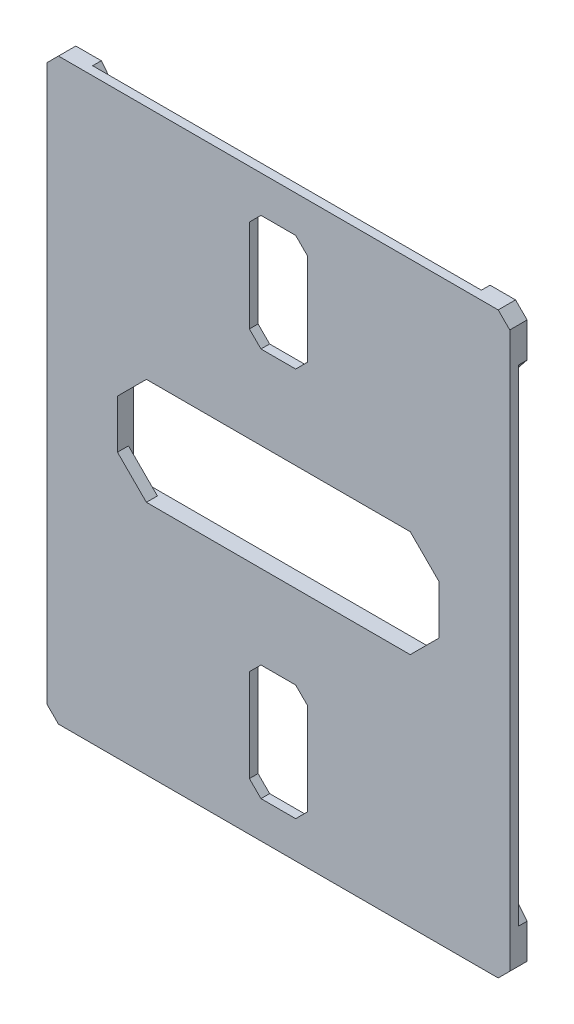
from build123d import *

# Parameters (mm, degrees)
ESBO_O2_W                = 80
ESBO_O2_H                = 100
ESBO_O2_W_2              = 55.6
ESBO_O2_H_2              = 18.4
RESSALTO_EXTRUS_O1_DEPTH = 0.8
RESSALTO_EXTRUS_O2_DEPTH = 2.2
CHANFRO3_SIZE            = 5
ESBO_O5_W                = 10
ESBO_O5_H                = 20
CORTE_EXTRUS_O1_DEPTH    = 10
CHANFRO4_SIZE            = 2
CHANFRO5_SIZE            = 2
RESSALTO_EXTRUS_O3_DEPTH = 0.7
ESBO_O7_W                = 61.8
ESBO_O7_H                = 24.6
ESBO_O7_W_2              = 55.6
ESBO_O7_H_2              = 18.4
RESSALTO_EXTRUS_O4_DEPTH = 2
ESBO_O8_W                = 61.8
ESBO_O8_H                = 24.6
RESSALTO_EXTRUS_O5_DEPTH = 0.6
CHANFRO6_SIZE            = 5
ESBO_O11_W               = 55.6
ESBO_O11_H               = 18.4
CORTE_EXTRUS_O2_DEPTH    = 0.9


with BuildPart() as part:
    # Esboço2 → Ressalto-extrusão1 (new body)
    with BuildSketch(Plane.XY):
        Rectangle(ESBO_O2_W, ESBO_O2_H)
        Rectangle(ESBO_O2_W_2, ESBO_O2_H_2, mode=Mode.SUBTRACT)
    extrude(amount=RESSALTO_EXTRUS_O1_DEPTH)

    # Esboço4 → Ressalto-extrusão2 (add)
    with BuildSketch(Plane(origin=(0, 0, 0), x_dir=(-1, 0, 0), z_dir=(0, 0, -1))):
        Polygon((40, -41.996094703), (20.243124237, -17.3), (35.9, -17.3), (35.9, 17.3), (20.243124237, 17.3), (40, 41.996094703), (40, 50), (33.596875763, 50), (7.436875763, 17.3), (-7.436875763, 17.3), (-33.596875763, 50), (-40, 50), (-40, 41.996094703), (-20.243124237, 17.3), (-35.9, 17.3), (-35.9, -17.3), (-20.243124237, -17.3), (-40, -41.996094703), (-40, -50), (-33.596875763, -50), (-7.436875763, -17.3), (7.436875763, -17.3), (33.596875763, -50), (40, -50), align=None)
        Polygon((3.436875763, 12.3), (5, 12.3), (16.243124237, 12.3), (30.9, 12.3), (30.9, -12.3), (16.243124237, -12.3), (5, -12.3), (3.436875763, -12.3), (-3.436875763, -12.3), (-5, -12.3), (-16.243124237, -12.3), (-30.9, -12.3), (-30.9, 12.3), (-16.243124237, 12.3), (-5, 12.3), (-2.810379517, 12.3), align=None, mode=Mode.SUBTRACT)
    extrude(amount=RESSALTO_EXTRUS_O2_DEPTH)

    # Chanfro3
    chanfro3_edges = [part.edges().sort_by_distance(p)[0] for p in [
        (-35.9, 17.3, -1.1),
        (35.9, 17.3, -1.1),
        (35.9, -17.3, -1.1),
        (-35.9, -17.3, -1.1),
    ]]
    chamfer(chanfro3_edges, length=CHANFRO3_SIZE)

    # Esboço5 → Corte-extrusão1 (cut)
    with BuildSketch(Plane(origin=(0, 0, 0), x_dir=(-1, 0, 0), z_dir=(0, 0, -1))):
        with Locations((0, 33.65)):
            Rectangle(ESBO_O5_W, ESBO_O5_H)
        with Locations((0, -33.65)):
            Rectangle(ESBO_O5_W, ESBO_O5_H)
    extrude(amount=-CORTE_EXTRUS_O1_DEPTH, mode=Mode.SUBTRACT)

    # Chanfro4
    chanfro4_edges = [part.edges().sort_by_distance(p)[0] for p in [
        (-5, 43.65, 0.4),
        (-5, 23.65, 0.4),
        (5, 23.65, 0.4),
        (5, 43.65, 0.4),
        (-5, -23.65, 0.4),
        (-5, -43.65, 0.4),
        (5, -43.65, 0.4),
        (5, -23.65, 0.4),
    ]]
    chamfer(chanfro4_edges, length=CHANFRO4_SIZE)

    # Chanfro5
    chanfro5_edges = [part.edges().sort_by_distance(p)[0] for p in [
        (-40, 50, -0.7),
        (40, 50, -0.7),
        (40, -50, -0.7),
        (-40, -50, -0.7),
    ]]
    chamfer(chanfro5_edges, length=CHANFRO5_SIZE)

    # Esboço6 → Ressalto-extrusão3 (add)
    # profile 1 of 4: a face of its own
    with BuildSketch(Plane(origin=(0, 0, 0), x_dir=(-1, 0, 0), z_dir=(0, 0, -1))):
        Polygon((30.9, -17.3), (20.243124237, -17.3), (40, -41.996094703), (40, 41.996094703), (20.243124237, 17.3), (30.9, 17.3), (35.9, 12.3), (35.9, -12.3), align=None)
    # profile 2 of 4: a face of its own
    with BuildSketch(Plane(origin=(0, 0, 0), x_dir=(-1, 0, 0), z_dir=(0, 0, -1))):
        Polygon((33.596875763, 50), (-33.596875763, 50), (-7.436875763, 17.3), (7.436875763, 17.3), align=None)
        Polygon((3, 43.65), (5, 41.65), (5, 25.65), (3, 23.65), (-3, 23.65), (-5, 25.65), (-5, 41.65), (-3, 43.65), align=None, mode=Mode.SUBTRACT)
    # profile 3 of 4: a face of its own
    with BuildSketch(Plane(origin=(0, 0, 0), x_dir=(-1, 0, 0), z_dir=(0, 0, -1))):
        Polygon((-40, -41.996094703), (-20.243124237, -17.3), (-30.9, -17.3), (-35.9, -12.3), (-35.9, 12.3), (-30.9, 17.3), (-20.243124237, 17.3), (-40, 41.996094703), align=None)
    # profile 4 of 4: a face of its own
    with BuildSketch(Plane(origin=(0, 0, 0), x_dir=(-1, 0, 0), z_dir=(0, 0, -1))):
        Polygon((33.596875763, -50), (7.436875763, -17.3), (-7.436875763, -17.3), (-33.596875763, -50), align=None)
        Polygon((-5, -25.65), (-5, -41.65), (-3, -43.65), (3, -43.65), (5, -41.65), (5, -25.65), (3, -23.65), (-3, -23.65), align=None, mode=Mode.SUBTRACT)
    extrude(amount=RESSALTO_EXTRUS_O3_DEPTH)

    # Esboço7 → Ressalto-extrusão4 (add)
    with BuildSketch(Plane(origin=(0, 0, 0), x_dir=(-1, 0, 0), z_dir=(0, 0, -1))):
        Rectangle(ESBO_O7_W, ESBO_O7_H)
        Rectangle(ESBO_O7_W_2, ESBO_O7_H_2, mode=Mode.SUBTRACT)
    extrude(amount=RESSALTO_EXTRUS_O4_DEPTH)

    # Esboço8 → Ressalto-extrusão5 (add)
    with BuildSketch(Plane(origin=(0, 0, -2.2), x_dir=(-1, 0, 0), z_dir=(0, 0, -1))):
        Polygon((30.9, 17.3), (-30.9, 17.3), (-35.9, 12.3), (-35.9, -12.3), (-30.9, -17.3), (30.9, -17.3), (35.9, -12.3), (35.9, 12.3), align=None)
        Rectangle(ESBO_O8_W, ESBO_O8_H, mode=Mode.SUBTRACT)
    extrude(amount=RESSALTO_EXTRUS_O5_DEPTH)

    # Chanfro6
    chanfro6_edges = [part.edges().sort_by_distance(p)[0] for p in [
        (-27.8, -9.2, -0.6),
        (27.8, -9.2, -0.6),
        (27.8, 9.2, -0.6),
        (-27.8, 9.2, -0.6),
    ]]
    chamfer(chanfro6_edges, length=CHANFRO6_SIZE)

    # Esboço11 → Corte-extrusão2 (cut)
    with BuildSketch(Plane(origin=(0, 0, -2), x_dir=(-1, 0, 0), z_dir=(0, 0, -1))):
        Rectangle(ESBO_O11_W, ESBO_O11_H)
    extrude(amount=-CORTE_EXTRUS_O2_DEPTH, mode=Mode.SUBTRACT)


solid = part.part
